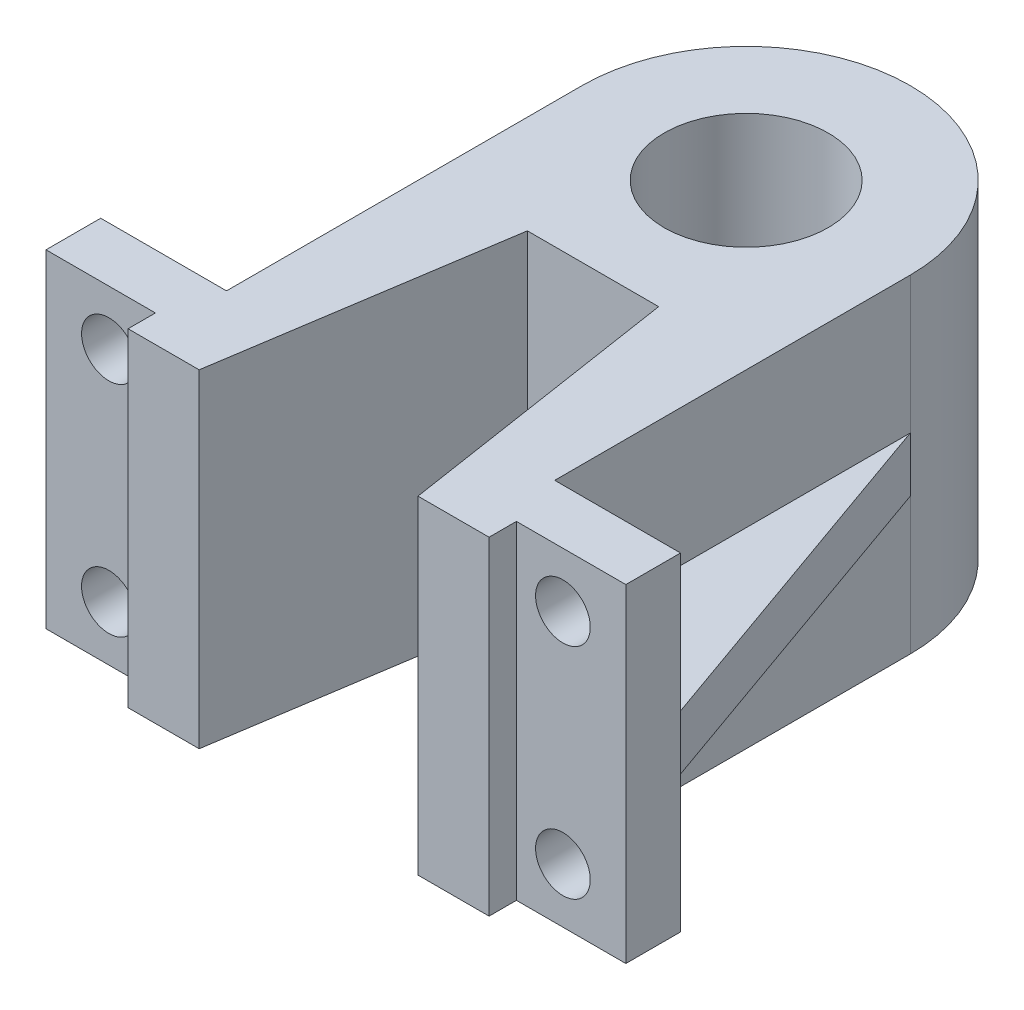
from build123d import *

# Parameters (mm, degrees)
SKETCH2_R           = 15
BOSS_EXTRUDE1_DEPTH = 60
SKETCH3_R           = 5
CUT_EXTRUDE1_DEPTH  = 60
RIB1_REACH          = 102.544
SKETCH7_WALL_W      = 272.036302532
SKETCH7_WALL_H      = 10


with BuildPart() as part:
    # Sketch2 → Boss-Extrude1 (new body)
    with BuildSketch(Plane(origin=(0, 0, 0), x_dir=(1, 0, 0), z_dir=(0, 1, 0))):
        with BuildLine():
            Line((30, 0), (30, -65))
            Line((30, -65), (53, -65))
            Line((53, -65), (53, -75))
            Line((53, -75), (33, -75))
            Line((33, -75), (33, -80))
            Line((33, -80), (20, -80))
            Line((20, -80), (12, -28))
            Line((12, -28), (-12, -28))
            Line((-12, -28), (-20, -80))
            Line((-20, -80), (-33, -80))
            Line((-33, -80), (-33, -75))
            Line((-33, -75), (-53, -75))
            Line((-53, -75), (-53, -65))
            Line((-53, -65), (-30, -65))
            Line((-30, -65), (-30, 0))
            ThreePointArc((-30, 0), (0, 30), (30, 0))
        make_face()
        with Locations(Location((0, 0, 0), (0, 0, 270))):
            Circle(SKETCH2_R, mode=Mode.SUBTRACT)
    extrude(amount=-BOSS_EXTRUDE1_DEPTH)

    # Sketch3 → Cut-Extrude1 (cut)
    with BuildSketch(Plane(origin=(0, 0, 65), x_dir=(-1, 0, 0), z_dir=(0, 0, -1))):
        with Locations((-41.5, -10)):
            Circle(SKETCH3_R)
        with Locations(Location((41.5, -10, 0), (0, 0, 180))):
            Circle(SKETCH3_R)
        with Locations((41.5, -50)):
            Circle(SKETCH3_R)
        with Locations((-41.5, -50)):
            Circle(SKETCH3_R)
    extrude(amount=-CUT_EXTRUDE1_DEPTH, mode=Mode.SUBTRACT)

    # Sketch7 wall → Rib1 (add, up to next)
    with BuildSketch(Plane(origin=(41.5, -30, 32.5), x_dir=(0.333578650439, 0, 0.942722272979), z_dir=(0.942722272979, 0, -0.333578650439)), mode=Mode.PRIVATE) as rib1_sk1:
        Rectangle(SKETCH7_WALL_W, SKETCH7_WALL_H)
    rib1_tool1 = extrude(rib1_sk1.sketch, amount=-RIB1_REACH, mode=Mode.PRIVATE) - part.part
    rib1 = rib1_tool1.solids().sort_by_distance((41.5, -30, 32.5))[0]
    add(rib1)

    # Mirror1: Rib1 across plane
    add(rib1.mirror(Plane(origin=(0, 0, 0), x_dir=(0, 0, 1), z_dir=(1, 0, 0))))


solid = part.part
